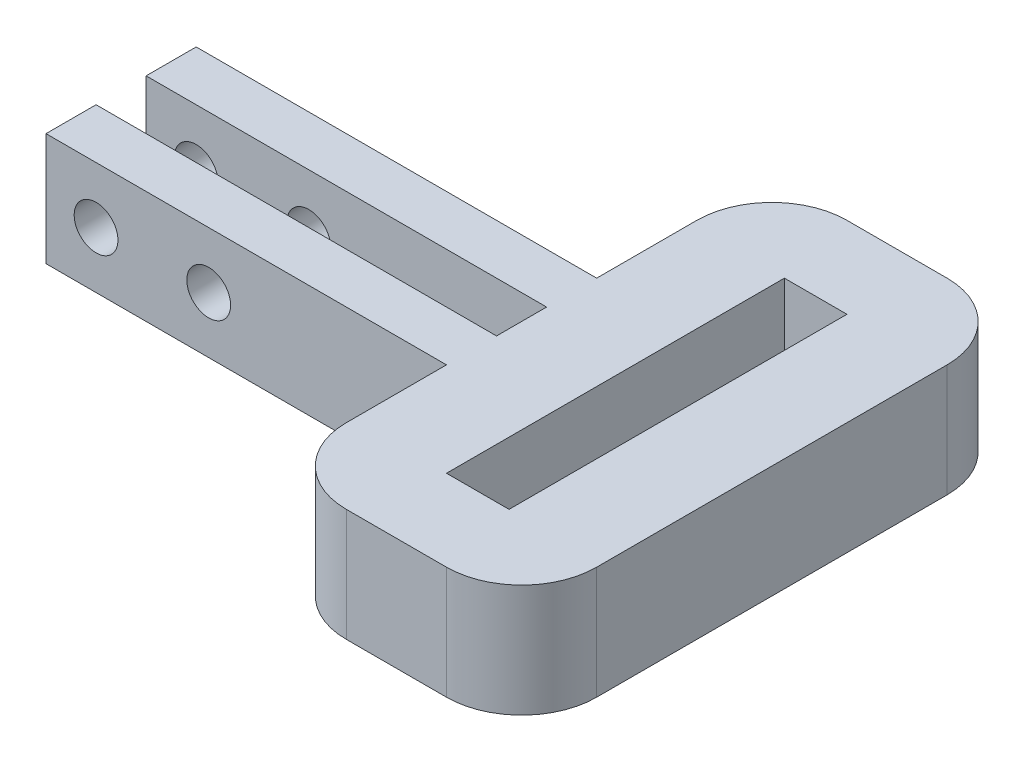
from build123d import *

# Parameters (mm, degrees)
CROQUIS1_W                 = 2.5
CROQUIS1_H                 = 13.5
SALIENTE_EXTRUIR1_DEPTH    = 4.5
CORTAR_EXTRUIR4_DEPTH      = 10
CORTAR_EXTRUIR4_DEPTH_BACK = 26.104780421
CROQUIS7_R                 = 0.875


with BuildPart() as part:
    # Croquis1 → Saliente-Extruir1 (new body)
    with BuildSketch(Plane(origin=(0, 0, 0), x_dir=(1, 0, 0), z_dir=(0, 1, 0))):
        with BuildLine():
            Line((-2, -10), (2, -10))
            ThreePointArc((2, -10), (4.121320344, -9.121320344), (5, -7))
            Line((5, -7), (5, 7))
            ThreePointArc((5, 7), (4.121320344, 9.121320344), (2, 10))
            Line((2, 10), (-2, 10))
            ThreePointArc((-2, 10), (-4.121320344, 9.121320344), (-5, 7))
            Line((-5, 7), (-5, 3))
            Line((-5, 3), (-21, 3))
            Line((-21, 3), (-21, 1))
            Line((-21, 1), (-5, 1))
            Line((-5, 1), (-5, -1))
            Line((-5, -1), (-21, -1))
            Line((-21, -1), (-21, -3))
            Line((-21, -3), (-5, -3))
            Line((-5, -3), (-5, -7))
            ThreePointArc((-5, -7), (-4.121320344, -9.121320344), (-2, -10))
        make_face()
        Rectangle(CROQUIS1_W, CROQUIS1_H, mode=Mode.SUBTRACT)
    extrude(amount=SALIENTE_EXTRUIR1_DEPTH)

    # Croquis7 → Cortar-Extruir4 (cut, two sides: drawn at the far end of the back side and taken through both)
    with BuildSketch(Plane.XY.offset(3).offset(-CORTAR_EXTRUIR4_DEPTH_BACK)):
        with Locations(Location((-19, 2.25, 0), (0, 0, 180))):
            Circle(CROQUIS7_R)
        with Locations(Location((-14.5, 2.25, 0), (0, 0, 180))):
            Circle(CROQUIS7_R)
    extrude(amount=CORTAR_EXTRUIR4_DEPTH + CORTAR_EXTRUIR4_DEPTH_BACK, mode=Mode.SUBTRACT)


solid = part.part
